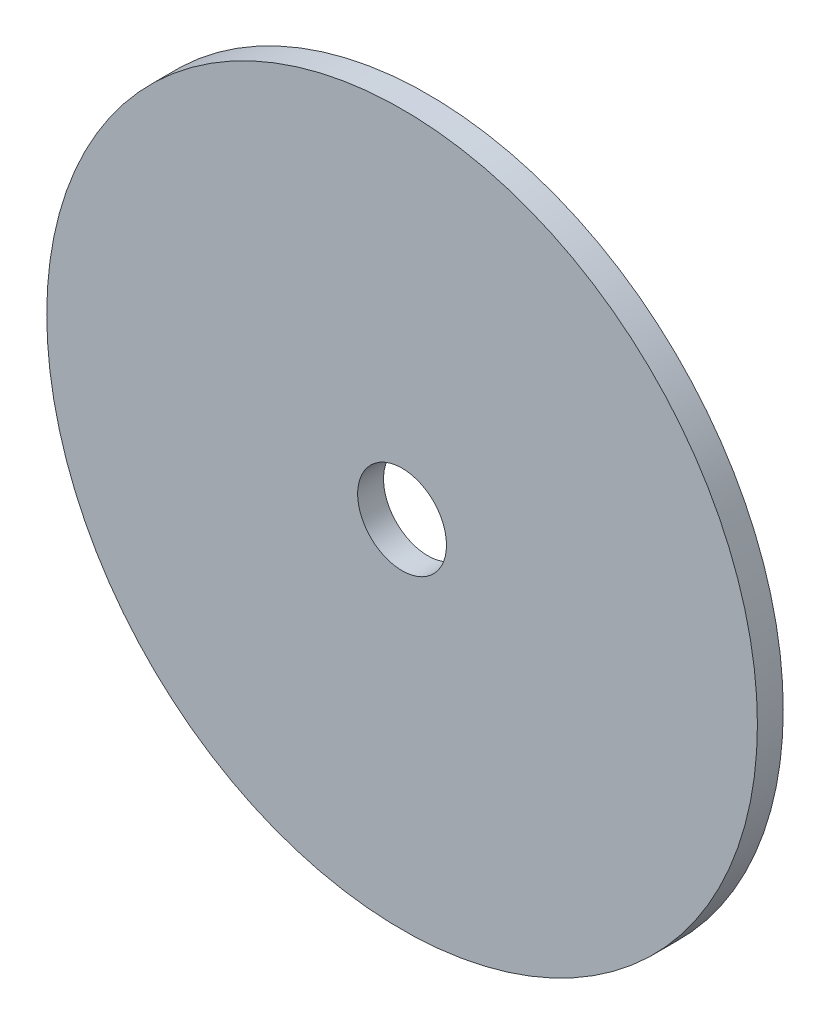
from build123d import *

# Parameters (mm, degrees)
BOSS_EXTRU_1_DEPTH      = 1.2
BOSS_EXTRU_1_DEPTH_BACK = 3.162331296
ESQUISSE1_R             = 60
ESQUISSE1_R_2           = 58
ESQUISSE1_R_3           = 25
ESQUISSE1_R_4           = 23
ESQUISSE1_R_5           = 7.5


with BuildPart() as part:
    # Esquisse1 → Boss.-Extru.1 (new, two sides: drawn at the far end of the back side and taken through both)
    # profile 1 of 4: a face of its own
    with BuildSketch(Plane.XY.offset(-BOSS_EXTRU_1_DEPTH_BACK)):
        Circle(ESQUISSE1_R)
        Circle(ESQUISSE1_R_2, mode=Mode.SUBTRACT)
    # profile 2 of 4: a face of its own
    with BuildSketch(Plane.XY.offset(-BOSS_EXTRU_1_DEPTH_BACK)):
        Circle(ESQUISSE1_R_2)
        Circle(ESQUISSE1_R_3, mode=Mode.SUBTRACT)
    # profile 3 of 4: a face of its own
    with BuildSketch(Plane.XY.offset(-BOSS_EXTRU_1_DEPTH_BACK)):
        Circle(ESQUISSE1_R_3)
        Circle(ESQUISSE1_R_4, mode=Mode.SUBTRACT)
    # profile 4 of 4: a face of its own
    with BuildSketch(Plane.XY.offset(-BOSS_EXTRU_1_DEPTH_BACK)):
        Circle(ESQUISSE1_R_4)
        Circle(ESQUISSE1_R_5, mode=Mode.SUBTRACT)
    extrude(amount=BOSS_EXTRU_1_DEPTH + BOSS_EXTRU_1_DEPTH_BACK)


solid = part.part
